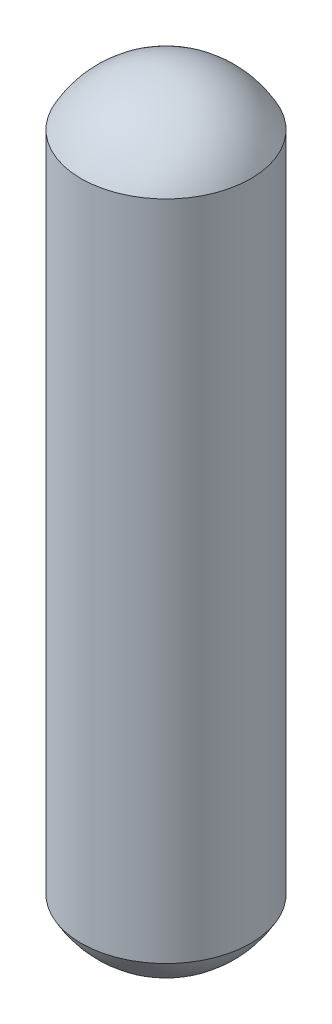
from build123d import *


with BuildPart() as part:
    # Sketch1 → Revolve1 (revolve)
    with BuildSketch(Plane.XY):
        with BuildLine():
            Line((2, -1.2), (2, -16.8))
            ThreePointArc((2, -16.8), (1.166190379, -17.676983965), (0, -18))
            Line((0, -18), (0, 0))
            ThreePointArc((0, 0), (1.166190379, -0.323016035), (2, -1.2))
        make_face()
    revolve(axis=Axis((0, 5, 0), (0, -1, 0)))


solid = part.part
